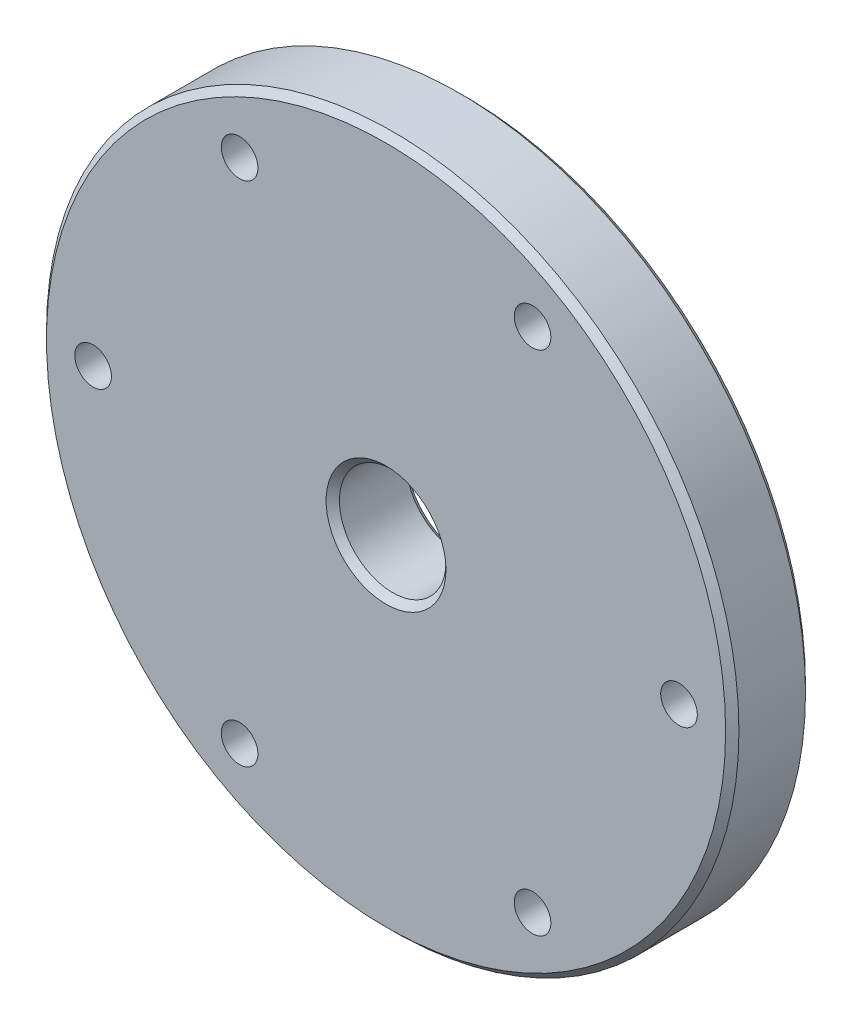
from build123d import *

# Parameters (mm, degrees)
SK_DISC_R          = 52
EXT_DISC_DEPTH     = 12
SK_C16_R           = 8
CUT_C16_DEPTH      = 12
CHAMFER_C1_SIZE    = 1
SK_BOLT88_R        = 2.75
CUT_BOLT88_DEPTH   = 12
SK_GROOVE70_R      = 36.9
SK_GROOVE70_R_2    = 33.1
CUT_GROOVE70_DEPTH = 2.4


with BuildPart() as part:
    # Sk_disc → Ext_disc (new body)
    with BuildSketch(Plane.XY):
        Circle(SK_DISC_R)
    extrude(amount=EXT_DISC_DEPTH)

    # Sk_c16 → Cut_c16 (cut)
    with BuildSketch(Plane.XY):
        Circle(SK_C16_R)
    extrude(amount=CUT_C16_DEPTH, mode=Mode.SUBTRACT)

    # Chamfer_C1
    chamfer_c1_edges = [part.edges().sort_by_distance(p)[0] for p in [
        (-52, 0, 0),
        (-52, 0, 12),
        (-8, 0, 0),
        (-8, 0, 12),
    ]]
    chamfer(chamfer_c1_edges, length=CHAMFER_C1_SIZE)

    # Sk_bolt88 → Cut_bolt88 (cut)
    with BuildSketch(Plane.XY):
        with Locations((44, 0)):
            Circle(SK_BOLT88_R)
        with Locations((22, 38.1051)):
            Circle(SK_BOLT88_R)
        with Locations((-22, 38.1051)):
            Circle(SK_BOLT88_R)
        with Locations((-44, 0)):
            Circle(SK_BOLT88_R)
        with Locations((-22, -38.1051)):
            Circle(SK_BOLT88_R)
        with Locations((22, -38.1051)):
            Circle(SK_BOLT88_R)
    extrude(amount=CUT_BOLT88_DEPTH, mode=Mode.SUBTRACT)

    # Sk_seat → Cut_seatR40 (revolve, cut)
    with BuildSketch(Plane(origin=(0, 0, 0), x_dir=(1, 0, 0), z_dir=(0, 1, 0)), mode=Mode.PRIVATE) as cut_seatr40_sk:
        with BuildLine():
            Line((10, -4.0888), (10, 0))
            Line((10, 0), (20, 0))
            ThreePointArc((20, 0), (15.138690108, -2.383595138), (10, -4.0888))
        make_face()
    revolve(cut_seatr40_sk.sketch.rotate(Axis((0, 0, 0), (0, 0, 1)), 180), axis=Axis((0, 0, 0), (0, 0, 1)), mode=Mode.SUBTRACT)

    # Sk_groove70 → Cut_groove70 (cut)
    with BuildSketch(Plane.XY):
        Circle(SK_GROOVE70_R)
        Circle(SK_GROOVE70_R_2, mode=Mode.SUBTRACT)
    extrude(amount=CUT_GROOVE70_DEPTH, mode=Mode.SUBTRACT)


solid = part.part
